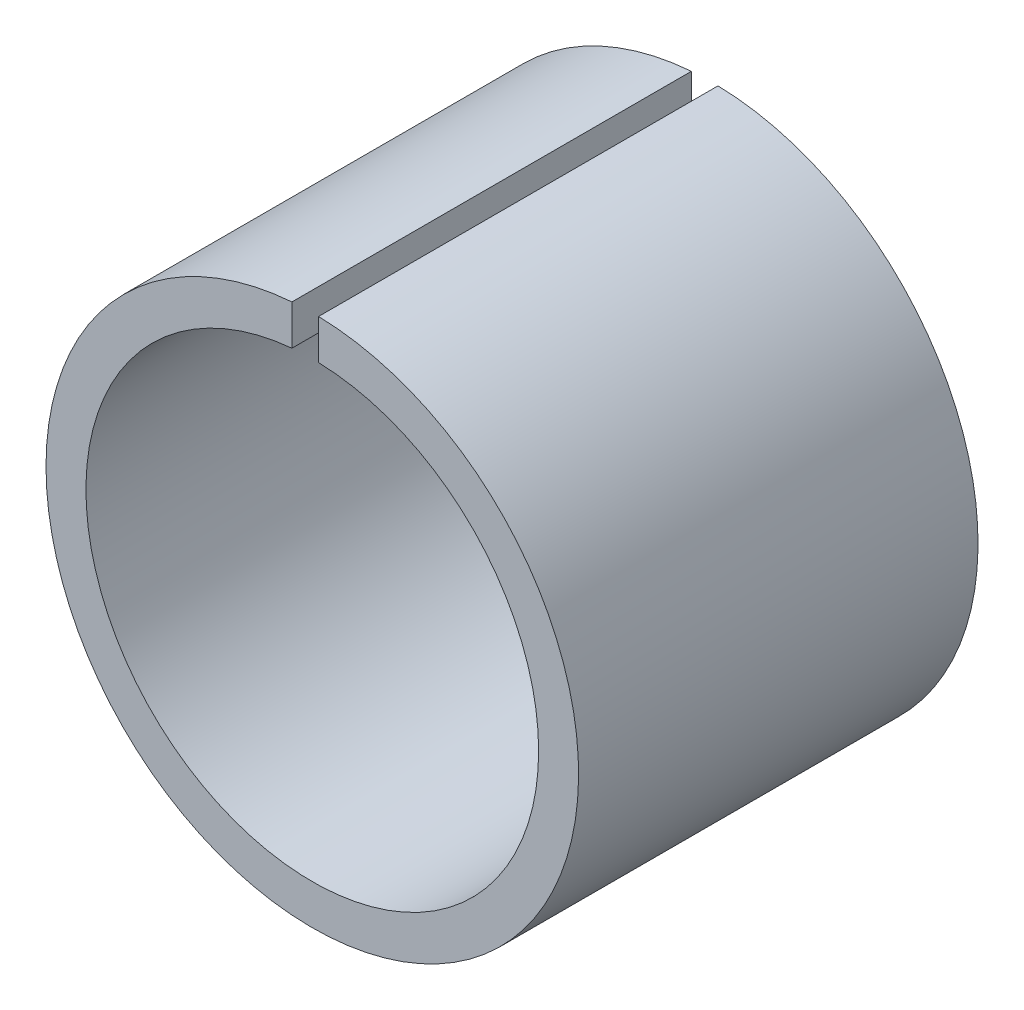
from build123d import *

# Parameters (mm, degrees)
SKETCH1_R           = 10
BOSS_EXTRUDE1_DEPTH = 15
SKETCH3_R           = 8.5
CUT_EXTRUDE1_DEPTH  = 19
SKETCH4_W           = 1
SKETCH4_H           = 15
CUT_EXTRUDE3_DEPTH  = 3


with BuildPart() as part:
    # Sketch1 → Boss-Extrude1 (new body)
    with BuildSketch(Plane.XY):
        Circle(SKETCH1_R)
    extrude(amount=BOSS_EXTRUDE1_DEPTH)

    # Sketch3 → Cut-Extrude1 (cut)
    with BuildSketch(Plane.XY.offset(15)):
        Circle(SKETCH3_R)
    extrude(amount=-CUT_EXTRUDE1_DEPTH, mode=Mode.SUBTRACT)

    # Sketch4 → Cut-Extrude3 (cut)
    with BuildSketch(Plane(origin=(0, 8, 0), x_dir=(1, 0, 0), z_dir=(0, 1, 0))):
        with Locations((-0.265251336, -7.5)):
            Rectangle(SKETCH4_W, SKETCH4_H)
    extrude(amount=CUT_EXTRUDE3_DEPTH, mode=Mode.SUBTRACT)


solid = part.part
